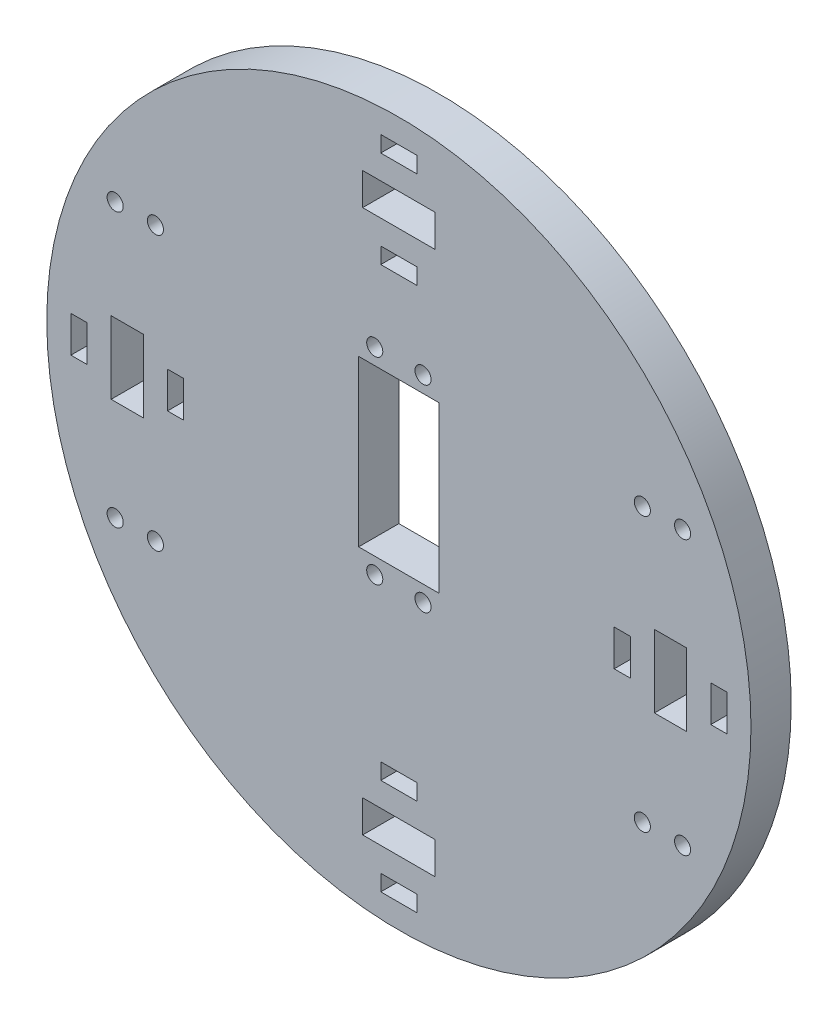
from build123d import *

# Parameters (mm, degrees)
SKETCH1_R           = 87.5
SKETCH1_R_2         = 2
SKETCH1_W           = 20
SKETCH1_H           = 41
SKETCH1_W_2         = 18
SKETCH1_H_2         = 8
SKETCH1_W_3         = 8
SKETCH1_H_3         = 18
SKETCH1_W_4         = 9
SKETCH1_H_4         = 4
SKETCH1_W_5         = 4
SKETCH1_H_5         = 9
BOSS_EXTRUDE2_DEPTH = 10


with BuildPart() as part:
    # Sketch1 → Boss-Extrude2 (new body)
    with BuildSketch(Plane.XY):
        with Locations((-18.556626979, 51.967802173)):
            Circle(SKETCH1_R)
        with Locations((41.943373021, 85.967802173)):
            Circle(SKETCH1_R_2, mode=Mode.SUBTRACT)
        with Locations((51.943373021, 85.967802173)):
            Circle(SKETCH1_R_2, mode=Mode.SUBTRACT)
        with Locations((-12.556626979, 86.967802173)):
            Circle(SKETCH1_R_2, mode=Mode.SUBTRACT)
        with Locations(Location((-24.556626979, 86.967802173, 0), (0, 0, 180))):
            Circle(SKETCH1_R_2, mode=Mode.SUBTRACT)
        with Locations(Location((-12.556626979, 37.967802173, 0), (0, 0, 180))):
            Circle(SKETCH1_R_2, mode=Mode.SUBTRACT)
        with Locations((-24.556626979, 37.967802173)):
            Circle(SKETCH1_R_2, mode=Mode.SUBTRACT)
        with Locations(Location((51.943373021, 17.967802173, 0), (0, 0, 180))):
            Circle(SKETCH1_R_2, mode=Mode.SUBTRACT)
        with Locations(Location((41.943373021, 17.967802173, 0), (0, 0, 180))):
            Circle(SKETCH1_R_2, mode=Mode.SUBTRACT)
        with Locations(Location((-89.056626979, 85.967802173, 0), (0, 0, 180))):
            Circle(SKETCH1_R_2, mode=Mode.SUBTRACT)
        with Locations(Location((-79.056626979, 85.967802173, 0), (0, 0, 180))):
            Circle(SKETCH1_R_2, mode=Mode.SUBTRACT)
        with Locations((-79.056626979, 17.967802173)):
            Circle(SKETCH1_R_2, mode=Mode.SUBTRACT)
        with Locations((-89.056626979, 17.967802173)):
            Circle(SKETCH1_R_2, mode=Mode.SUBTRACT)
        with Locations((-18.556626979, 62.467802173)):
            Rectangle(SKETCH1_W, SKETCH1_H, mode=Mode.SUBTRACT)
        with Locations((-18.556626979, -15.532197827)):
            Rectangle(SKETCH1_W_2, SKETCH1_H_2, mode=Mode.SUBTRACT)
        with Locations((-18.556626979, 119.467802173)):
            Rectangle(SKETCH1_W_2, SKETCH1_H_2, mode=Mode.SUBTRACT)
        with Locations((-86.056626979, 51.967802173)):
            Rectangle(SKETCH1_W_3, SKETCH1_H_3, mode=Mode.SUBTRACT)
        with Locations((48.943373021, 51.967802173)):
            Rectangle(SKETCH1_W_3, SKETCH1_H_3, mode=Mode.SUBTRACT)
        with Locations((-18.556626979, 131.467802173)):
            Rectangle(SKETCH1_W_4, SKETCH1_H_4, mode=Mode.SUBTRACT)
        with Locations((-18.556626979, 107.467802173)):
            Rectangle(SKETCH1_W_4, SKETCH1_H_4, mode=Mode.SUBTRACT)
        with Locations((-18.556626979, -27.532197827)):
            Rectangle(SKETCH1_W_4, SKETCH1_H_4, mode=Mode.SUBTRACT)
        with Locations((-18.556626979, -3.532197827)):
            Rectangle(SKETCH1_W_4, SKETCH1_H_4, mode=Mode.SUBTRACT)
        with Locations((60.943373021, 51.967802173)):
            Rectangle(SKETCH1_W_5, SKETCH1_H_5, mode=Mode.SUBTRACT)
        with Locations((36.943373021, 51.967802173)):
            Rectangle(SKETCH1_W_5, SKETCH1_H_5, mode=Mode.SUBTRACT)
        with Locations((-74.056626979, 51.967802173)):
            Rectangle(SKETCH1_W_5, SKETCH1_H_5, mode=Mode.SUBTRACT)
        with Locations((-98.056626979, 51.967802173)):
            Rectangle(SKETCH1_W_5, SKETCH1_H_5, mode=Mode.SUBTRACT)
    extrude(amount=BOSS_EXTRUDE2_DEPTH)


solid = part.part
